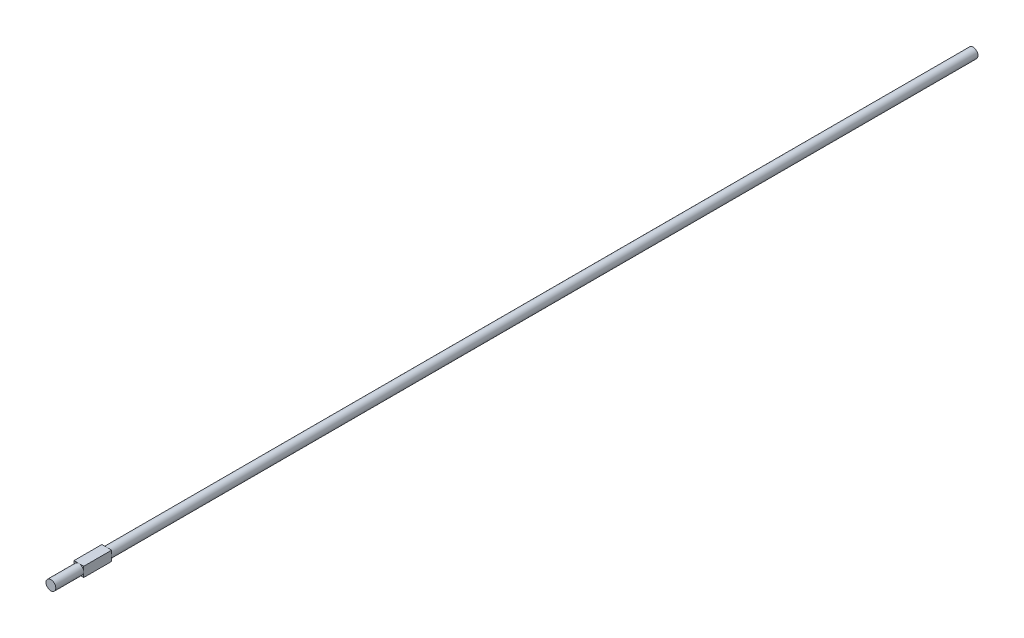
from build123d import *

# Parameters (mm, degrees)
SKETCH_1_R          = 3.5
EXTRUDE_1_DEPTH     = 660
CUT_EXTRUDE_1_DEPTH = 0.04
SKETCH_4_W          = 7
SKETCH_4_H          = 7
EXTRUDE_2_DEPTH     = 20


with BuildPart() as part:
    # 스케치1 → 보스-돌출1 (new body)
    with BuildSketch(Plane.XY):
        Circle(SKETCH_1_R)
    extrude(amount=EXTRUDE_1_DEPTH)

    # 스케치2 → 컷-돌출1 (cut)
    # profile 1 of 3: a face of its own
    with BuildSketch(Plane(origin=(0, 0, 0), x_dir=(-1, 0, 0), z_dir=(0, 0, -1))):
        Polygon((-2.009287992, 1.697777552), (-1.795586069, 1.697777552), (-1.795586069, 0.99561409), (-1.490297608, 0.99561409), (-1.490297608, 0.781912167), (-1.795586069, 0.781912167), (-1.795586069, -0.74453014), (-2.009287992, -0.74453014), (-2.009287992, 0.781912167), (-2.314576454, 0.781912167), (-2.314576454, 0.99561409), (-2.009287992, 0.99561409), align=None)
    # profile 2 of 3: a face of its own
    with BuildSketch(Plane(origin=(0, 0, 0), x_dir=(-1, 0, 0), z_dir=(0, 0, -1))):
        with BuildLine():
            add(Edge.make_bspline(
                [(-0.283454158, 1.026142937), (-0.250802953, 1.025447686), (-0.186781919, 1.024084469), (-0.09302334, 1.009514644), (-0.003525667, 0.98723474), (0.082053868, 0.95643391), (0.16261924, 0.915148511), (0.239343961, 0.865884333), (0.312017676, 0.807521533), (0.355576202, 0.762374347), (0.377686166, 0.739457991)],
                knots=[0, 0, 0, 0, 1.054011418, 2.066658804, 3.057071809, 4.030435133, 4.997543892, 5.974964718, 6.972108034, 8, 8, 8, 8], degree=3))
            add(Edge.make_bspline(
                [(0.377686166, 0.739457991), (0.396723888, 0.717540975), (0.434430901, 0.674131099), (0.48278097, 0.603744334), (0.524433496, 0.530850801), (0.557813832, 0.454482531), (0.584133464, 0.375306192), (0.602819947, 0.293049645), (0.613934897, 0.207894548), (0.615433701, 0.15006158), (0.616192777, 0.120771843)],
                knots=[0, 0, 0, 0, 1.025258237, 2.030674902, 3.01204498, 3.988269485, 4.97094183, 5.956517959, 6.965070386, 8, 8, 8, 8], degree=3))
            add(Edge.make_bspline(
                [(0.616192777, 0.120771843), (0.615525117, 0.091312339), (0.61420579, 0.033098986), (0.601725579, -0.052639189), (0.582314251, -0.13577531), (0.554534019, -0.215961314), (0.518911805, -0.293442309), (0.475443319, -0.367879877), (0.423823523, -0.439420882), (0.365310089, -0.507457847), (0.300640866, -0.57016379), (0.230485058, -0.624815702), (0.156221332, -0.671638917), (0.076862193, -0.709355479), (-0.006867651, -0.739093685), (-0.095148799, -0.759980661), (-0.187844105, -0.772609235), (-0.25113584, -0.774230916), (-0.283454158, -0.775058986)],
                knots=[0, 0, 0, 0, 0.998656419, 1.973391657, 2.932242238, 3.890759089, 4.846373663, 5.82037756, 6.809684879, 7.83454468, 8.860553229, 9.859544525, 10.845671541, 11.83227036, 12.833544569, 13.85385346, 14.904124723, 16, 16, 16, 16], degree=3))
            add(Edge.make_bspline(
                [(-0.283454158, -0.775058986), (-0.315930816, -0.774228137), (-0.37953799, -0.772600876), (-0.472560488, -0.760029725), (-0.560999854, -0.739103312), (-0.644839311, -0.70925775), (-0.724539645, -0.671637712), (-0.799233672, -0.624957259), (-0.869446472, -0.570147582), (-0.934129375, -0.507462239), (-0.992639141, -0.439419751), (-1.044259884, -0.367880171), (-1.087728124, -0.293442232), (-1.123350402, -0.215961334), (-1.151130617, -0.135775304), (-1.17054195, -0.052639191), (-1.183022159, 0.033098987), (-1.184341486, 0.091312339), (-1.185009146, 0.120771843)],
                knots=[0, 0, 0, 0, 1.099876186, 2.154163076, 3.173186993, 4.173200201, 5.163417411, 6.152872554, 7.150605724, 8.17532212, 9.198891216, 10.186952605, 11.159729845, 12.11414092, 13.071450619, 14.029093627, 15.002601286, 16, 16, 16, 16], degree=3))
            add(Edge.make_bspline(
                [(-1.185009146, 0.120771843), (-1.184244894, 0.149902386), (-1.182731806, 0.207575854), (-1.171628031, 0.292570872), (-1.153014442, 0.374688203), (-1.12666326, 0.453558929), (-1.092975246, 0.529592538), (-1.051908012, 0.602666182), (-1.003064743, 0.672734667), (-0.965507701, 0.71608844), (-0.946502536, 0.738026951)],
                knots=[0, 0, 0, 0, 1.031353054, 2.041901799, 3.029428768, 4.008703097, 4.981709435, 5.96992636, 6.972712378, 8, 8, 8, 8], degree=3))
            add(Edge.make_bspline(
                [(-0.946502536, 0.738026951), (-0.924425905, 0.761142044), (-0.881008326, 0.806601941), (-0.807972853, 0.864794604), (-0.731436878, 0.915083933), (-0.649981169, 0.955549001), (-0.564471939, 0.987415921), (-0.474515633, 1.009572102), (-0.380438898, 1.024031974), (-0.316104585, 1.02543227), (-0.283454158, 1.026142937)],
                knots=[0, 0, 0, 0, 1.027980169, 2.021703884, 2.998553061, 3.971491411, 4.943284454, 5.930300938, 6.949603206, 8, 8, 8, 8], degree=3))
        make_face()
        with BuildLine():
            add(Edge.make_bspline(
                [(-0.284408185, 0.812441014), (-0.307497881, 0.811784747), (-0.353081217, 0.810489154), (-0.420177756, 0.800634926), (-0.484770968, 0.785022428), (-0.546983399, 0.762840026), (-0.606605254, 0.734197739), (-0.663693615, 0.699017587), (-0.7184164, 0.657765522), (-0.769703125, 0.610506097), (-0.816771806, 0.558881281), (-0.857918429, 0.503875523), (-0.892905867, 0.446381026), (-0.922052476, 0.386338004), (-0.943760759, 0.323137987), (-0.95952669, 0.2574967), (-0.969371622, 0.189280408), (-0.970655033, 0.142906572), (-0.971307223, 0.119340803)],
                knots=[0, 0, 0, 0, 1.021534396, 2.016698045, 2.994645724, 3.958388632, 4.93408049, 5.916473867, 6.921342795, 7.962252576, 8.998418191, 10.008913653, 10.997312074, 11.973003931, 12.956656626, 13.948281152, 14.957379055, 16, 16, 16, 16], degree=3))
            add(Edge.make_bspline(
                [(-0.971307223, 0.119340803), (-0.970214009, 0.088893442), (-0.968044184, 0.028461123), (-0.950398961, -0.060537159), (-0.920880795, -0.145977669), (-0.881020521, -0.227359531), (-0.831078076, -0.302656206), (-0.772235982, -0.369788055), (-0.705125758, -0.427744831), (-0.630547389, -0.475833049), (-0.550024183, -0.51404174), (-0.46480515, -0.541119257), (-0.375922821, -0.558721248), (-0.315180038, -0.560470769), (-0.284408185, -0.561357063)],
                knots=[0, 0, 0, 0, 1.016792936, 2.018143844, 3.017858371, 4.030088057, 5.03801393, 6.028138512, 7.003788237, 7.991172063, 8.984598303, 9.972568034, 10.972917682, 12, 12, 12, 12], degree=3))
            add(Edge.make_bspline(
                [(-0.284408185, -0.561357063), (-0.253638102, -0.560465605), (-0.192898812, -0.55870589), (-0.104139979, -0.541207908), (-0.019153866, -0.513923096), (0.061285703, -0.475876021), (0.135830124, -0.427562217), (0.203423008, -0.370115325), (0.261762688, -0.302478401), (0.31165573, -0.227259797), (0.352168782, -0.146103836), (0.381548782, -0.060521389), (0.399236425, 0.028457107), (0.401400524, 0.088892096), (0.402490854, 0.119340803)],
                knots=[0, 0, 0, 0, 1.02726834, 2.027799167, 3.010890988, 4.004497153, 4.992059811, 5.971914811, 6.958719428, 7.966827853, 8.981595046, 9.981490638, 10.983022906, 12, 12, 12, 12], degree=3))
            add(Edge.make_bspline(
                [(0.402490854, 0.119340803), (0.401838888, 0.142906713), (0.400555919, 0.189280826), (0.390707773, 0.257495102), (0.374953736, 0.323143849), (0.353201618, 0.386316373), (0.324181655, 0.446536487), (0.288519516, 0.503706713), (0.247540907, 0.559071827), (0.199904259, 0.610339215), (0.148671068, 0.657783945), (0.093926104, 0.699033583), (0.036922396, 0.734043126), (-0.022526247, 0.763085014), (-0.084746655, 0.784820616), (-0.149249362, 0.800725074), (-0.216059624, 0.810447511), (-0.261479616, 0.811772263), (-0.284408185, 0.812441014)],
                knots=[0, 0, 0, 0, 1.042956736, 2.052379634, 3.044323526, 4.02829302, 5.004299113, 5.996692471, 7.007513377, 8.048758398, 9.090003419, 10.095195979, 11.07790575, 12.047570684, 13.018257071, 13.989683339, 14.985167495, 16, 16, 16, 16], degree=3))
        make_face(mode=Mode.SUBTRACT)
    # profile 3 of 3: a face of its own
    with BuildSketch(Plane(origin=(0, 0, 0), x_dir=(-1, 0, 0), z_dir=(0, 0, -1))):
        with BuildLine():
            Line((1.043596623, 0.99561409), (1.257298546, 0.99561409))
            Line((1.257298546, 0.99561409), (1.257298546, 0.673630166))
            add(Edge.make_bspline(
                [(1.257298546, 0.673630166), (1.279993549, 0.70284316), (1.324096744, 0.759612768), (1.400109581, 0.833084623), (1.480341928, 0.895048356), (1.566858464, 0.943613972), (1.658314582, 0.980231346), (1.754334962, 1.007295579), (1.85573455, 1.023244154), (1.92506053, 1.025163891), (1.960416034, 1.026142937)],
                knots=[0, 0, 0, 0, 1.0828784, 2.104357462, 3.088488658, 4.04616522, 5.001424249, 5.969181776, 6.964304535, 8, 8, 8, 8], degree=3))
            add(Edge.make_bspline(
                [(1.960416034, 1.026142937), (1.991298535, 1.025249506), (2.052339422, 1.023483593), (2.142189583, 1.01152764), (2.228714264, 0.991036853), (2.311423957, 0.96150873), (2.391204721, 0.925003848), (2.466875472, 0.878932079), (2.539614873, 0.825587867), (2.607593566, 0.764197779), (2.670405068, 0.69777569), (2.724728987, 0.626323016), (2.771586479, 0.552189542), (2.809462163, 0.474225993), (2.839131414, 0.393046303), (2.860232471, 0.308322489), (2.872790261, 0.220368679), (2.874475132, 0.160563435), (2.875327392, 0.130312107)],
                knots=[0, 0, 0, 0, 1.041296284, 2.058176809, 3.050446431, 4.034000596, 5.01514041, 6.003636468, 7.015969324, 8.052561599, 9.08815499, 10.094063707, 11.074456064, 12.040834395, 13.011057502, 13.983766392, 14.980127149, 16, 16, 16, 16], degree=3))
            add(Edge.make_bspline(
                [(2.875327392, 0.130312107), (2.874493624, 0.099422322), (2.872849314, 0.038503209), (2.860096015, -0.050954977), (2.839714642, -0.137011565), (2.810419699, -0.219523418), (2.772563615, -0.298433723), (2.726500334, -0.373685575), (2.672149006, -0.445254862), (2.610031631, -0.51216996), (2.542640259, -0.57380985), (2.470605752, -0.627720037), (2.395046019, -0.672991937), (2.316347634, -0.7108082), (2.233836887, -0.739309847), (2.147898746, -0.759868743), (2.05858, -0.772546856), (1.997823324, -0.774215188), (1.967094219, -0.775058986)],
                knots=[0, 0, 0, 0, 1.038740735, 2.04854663, 3.033179607, 4.009277356, 4.987731542, 5.972001279, 6.972200261, 8.005528982, 9.039189865, 10.040446548, 11.026516639, 11.997840187, 12.972163198, 13.956796175, 14.96660207, 16, 16, 16, 16], degree=3))
            add(Edge.make_bspline(
                [(1.967094219, -0.775058986), (1.932513317, -0.774178055), (1.864205898, -0.772437956), (1.764331055, -0.754803501), (1.668212339, -0.72844855), (1.576914653, -0.689872984), (1.489714767, -0.640713428), (1.407105934, -0.58076702), (1.328649358, -0.510159131), (1.281426614, -0.456593377), (1.257298546, -0.429224401)],
                knots=[0, 0, 0, 0, 1.014726462, 2.004382257, 2.969841629, 3.936926163, 4.907207904, 5.903978561, 6.929055279, 8, 8, 8, 8], degree=3))
            Line((1.257298546, -0.429224401), (1.257298546, -1.38563591))
            Line((1.257298546, -1.38563591), (1.043596623, -1.38563591))
            Line((1.043596623, -1.38563591), (1.043596623, 0.99561409))
        make_face()
        with BuildLine():
            add(Edge.make_bspline(
                [(1.958507981, 0.812441014), (1.934301172, 0.812005409), (1.886644203, 0.811147817), (1.816790426, 0.800960184), (1.749506215, 0.786170756), (1.685469673, 0.76377891), (1.624067021, 0.736293289), (1.565771188, 0.701947492), (1.510623093, 0.661362824), (1.458761488, 0.615316699), (1.411909855, 0.564579277), (1.370433291, 0.510431142), (1.335594035, 0.452940869), (1.306677482, 0.39264397), (1.284672499, 0.329067803), (1.269054411, 0.26257445), (1.259236617, 0.193091131), (1.257951465, 0.145768205), (1.257298546, 0.121725869)],
                knots=[0, 0, 0, 0, 1.05670511, 2.080379991, 3.077984906, 4.06214886, 5.038337365, 6.01289324, 7.01187578, 8.025460281, 9.038092164, 10.024533457, 11.000252242, 11.969694649, 12.940728589, 13.933144304, 14.949937299, 16, 16, 16, 16], degree=3))
            add(Edge.make_bspline(
                [(1.257298546, 0.121725869), (1.258380896, 0.090165386), (1.260501312, 0.028335725), (1.277739772, -0.062004901), (1.305794478, -0.147492902), (1.345614906, -0.227408358), (1.395925667, -0.300875251), (1.456544234, -0.366659396), (1.526922112, -0.42434728), (1.605889255, -0.47293924), (1.690540741, -0.512391835), (1.778841513, -0.540636325), (1.869577262, -0.558034573), (1.930923923, -0.560243569), (1.961847074, -0.561357063)],
                knots=[0, 0, 0, 0, 1.03728447, 2.032128127, 3.01272805, 3.987917167, 4.958271349, 5.931593992, 6.91984656, 7.941419022, 8.973179163, 9.983609215, 10.983593296, 12, 12, 12, 12], degree=3))
            add(Edge.make_bspline(
                [(1.961847074, -0.561357063), (1.992147301, -0.560298171), (2.052287807, -0.558196461), (2.140841814, -0.540004944), (2.226900624, -0.51221574), (2.308666062, -0.47169397), (2.385426328, -0.422034663), (2.454742171, -0.362462569), (2.51529866, -0.293413161), (2.566913516, -0.216527019), (2.608504759, -0.134084481), (2.639753725, -0.048780358), (2.657789023, 0.039084653), (2.660344981, 0.098274169), (2.661625469, 0.127927041)],
                knots=[0, 0, 0, 0, 1.00104056, 1.986885549, 2.97790532, 3.984399681, 4.995088187, 5.994304198, 6.996462723, 8.023150851, 9.048424203, 10.043036403, 11.019596776, 12, 12, 12, 12], degree=3))
            add(Edge.make_bspline(
                [(2.661625469, 0.127927041), (2.660635731, 0.157764096), (2.658663964, 0.217205746), (2.639241783, 0.304810507), (2.610054477, 0.39045929), (2.567491979, 0.47177595), (2.517008616, 0.548502603), (2.455948605, 0.616234795), (2.387493657, 0.675541985), (2.31082478, 0.724538184), (2.228542097, 0.763512779), (2.141922485, 0.792008612), (2.05140532, 0.809135752), (1.989746148, 0.811329568), (1.958507981, 0.812441014)],
                knots=[0, 0, 0, 0, 0.983928682, 1.960191568, 2.949917689, 3.96440592, 4.982380491, 5.975291189, 6.965713506, 7.964880129, 8.970154049, 9.96478489, 10.968906225, 12, 12, 12, 12], degree=3))
        make_face(mode=Mode.SUBTRACT)
    extrude(amount=-CUT_EXTRUDE_1_DEPTH, mode=Mode.SUBTRACT)

    # 스케치4 → 보스-돌출2 (add)
    with BuildSketch(Plane.XY.offset(620)):
        Rectangle(SKETCH_4_W, SKETCH_4_H)
    extrude(amount=EXTRUDE_2_DEPTH)


solid = part.part
